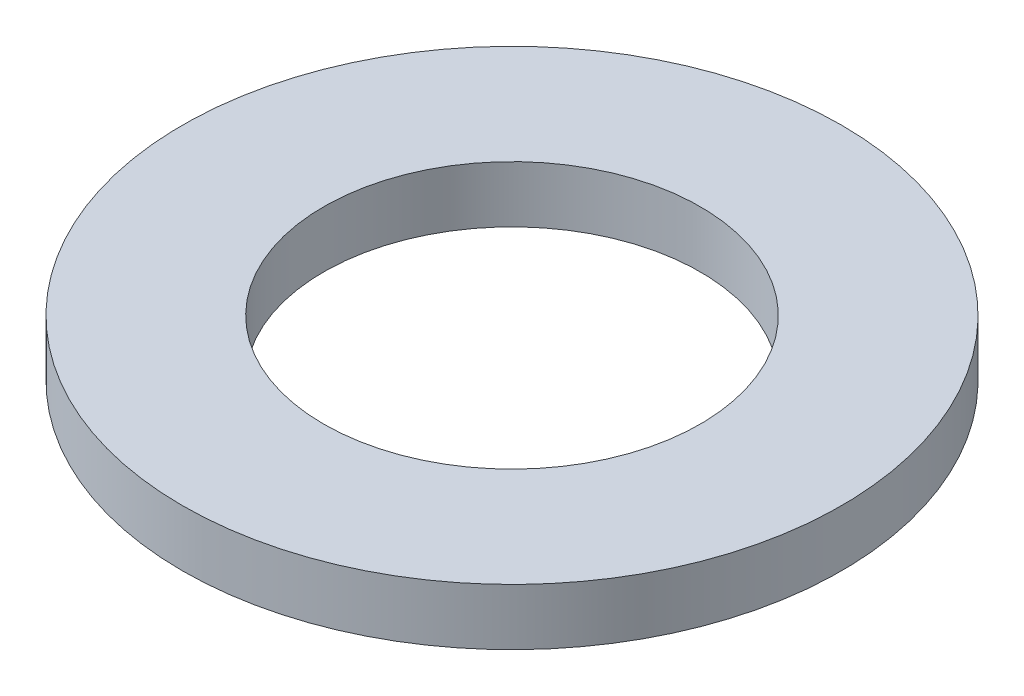
from build123d import *

# Parameters (mm, degrees)
SKETCH1_R           = 7
SKETCH1_R_2         = 4
BOSS_EXTRUDE1_DEPTH = 1.2


with BuildPart() as part:
    # Sketch1 → Boss-Extrude1 (new body)
    with BuildSketch(Plane(origin=(0, 0, 0), x_dir=(1, 0, 0), z_dir=(0, 1, 0))):
        with Locations(Location((0, 0, 0), (0, 0, 270))):
            Circle(SKETCH1_R)
        with Locations(Location((0, 0, 0), (0, 0, 270))):
            Circle(SKETCH1_R_2, mode=Mode.SUBTRACT)
    extrude(amount=BOSS_EXTRUDE1_DEPTH)


solid = part.part
